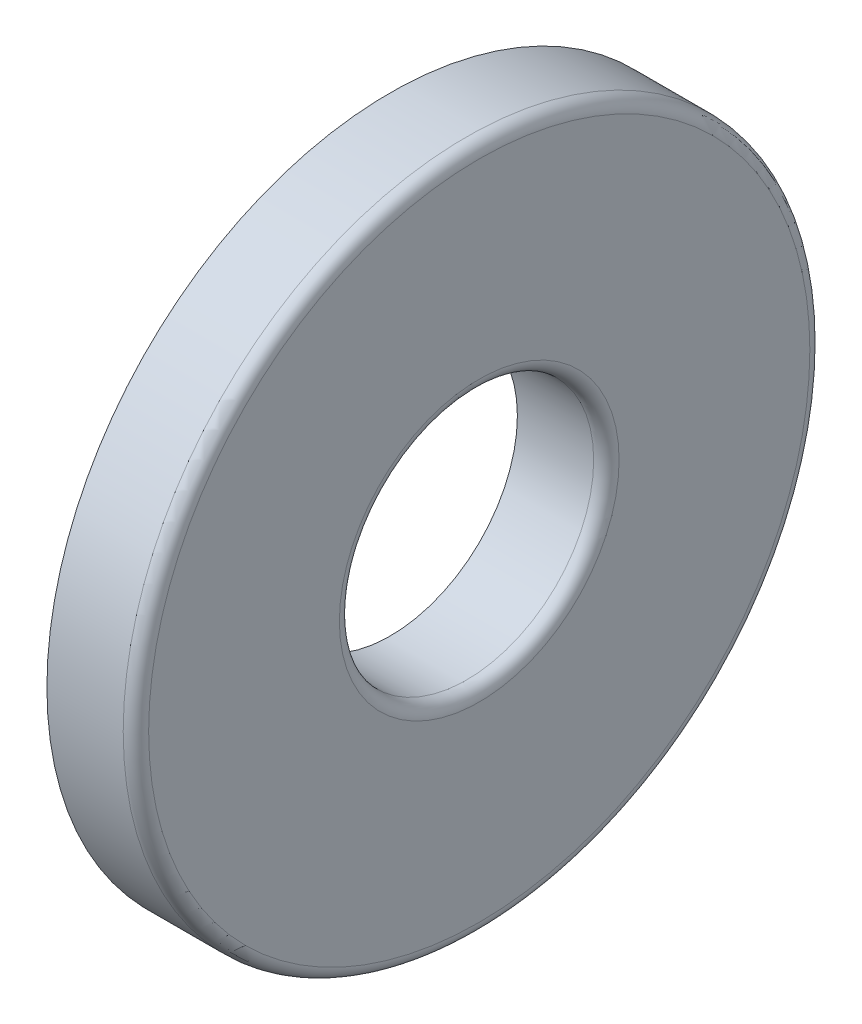
from build123d import *

# Parameters (mm, degrees)
CONG_1_R                = 0.5
ESQUISSE2_R             = 5
ENL_V_MAT_EXTRU_1_DEPTH = 20.410049083
CONG_2_R                = 0.5


with BuildPart() as part:
    # Esquisse1 → Base-Révolution (revolve)
    with BuildSketch(Plane.XY, mode=Mode.PRIVATE) as base_r_volution_sk:
        with BuildLine():
            Line((0, 0), (0, 7.341687605))
            ThreePointArc((0, 7.341687605), (0.5, 9), (0, 10.658312395))
            Line((0, 10.658312395), (0, 13.5))
            Line((0, 13.5), (3.5, 13.5))
            Line((3.5, 13.5), (3.5, 0))
            Line((3.5, 0), (0, 0))
        make_face()
    revolve(base_r_volution_sk.sketch.rotate(Axis((-2.5, 0, 0), (1, 0, 0)), 270), axis=Axis((-2.5, 0, 0), (1, 0, 0)))

    # Congé1
    cong_1_edges = [part.edges().sort_by_distance(p)[0] for p in [
        (3.5, 0, 13.5),
    ]]
    fillet(cong_1_edges, radius=CONG_1_R)

    # Esquisse2 → Enlèv. mat.-Extru.1 (cut, through all)
    with BuildSketch(Plane(origin=(3.5, 0, 0), x_dir=(0, 0, -1), z_dir=(1, 0, 0))):
        Circle(ESQUISSE2_R)
    extrude(amount=-ENL_V_MAT_EXTRU_1_DEPTH, mode=Mode.SUBTRACT)

    # Congé2
    cong_2_edges = [part.edges().sort_by_distance(p)[0] for p in [
        (3.5, 0, 5),
    ]]
    fillet(cong_2_edges, radius=CONG_2_R)


solid = part.part
